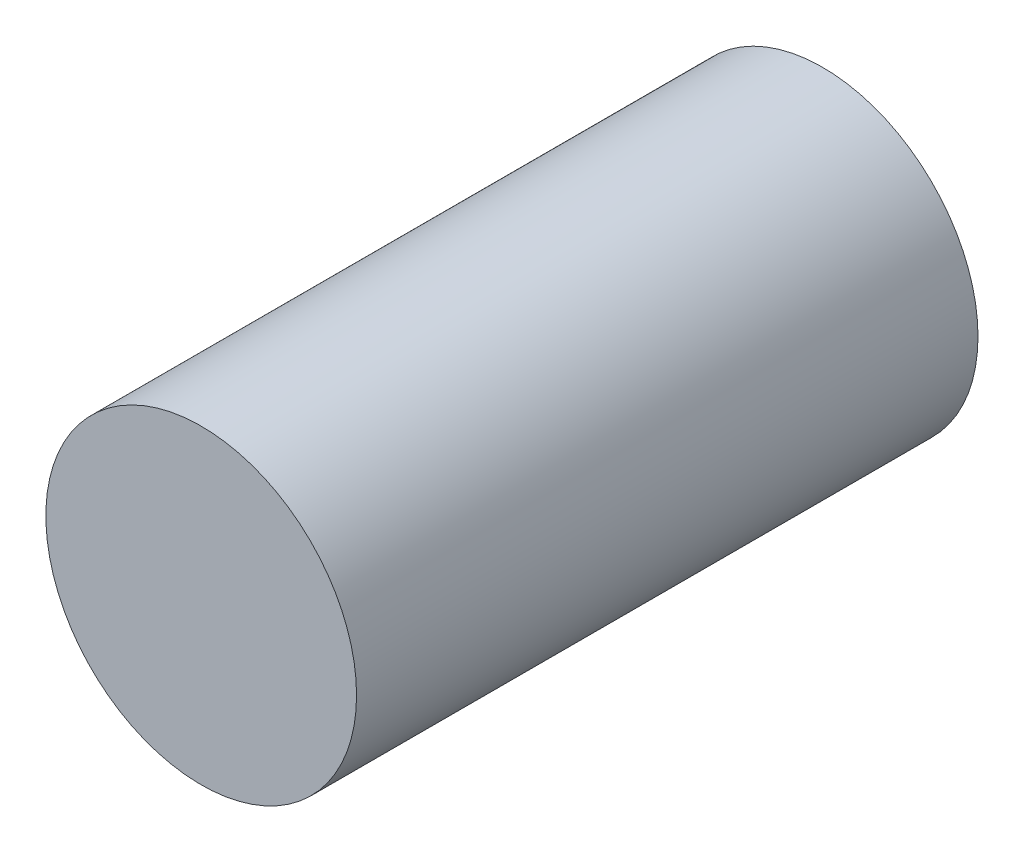
from build123d import *

# Parameters (mm, degrees)
IZIM1_R                     = 0.25
Y_KSEKLIK_EKSTR_ZYON1_DEPTH = 1


with BuildPart() as part:
    # Çizim1 → Yükseklik-Ekstrüzyon1 (new body)
    with BuildSketch(Plane.XY):
        Circle(IZIM1_R)
    extrude(amount=Y_KSEKLIK_EKSTR_ZYON1_DEPTH)


solid = part.part
